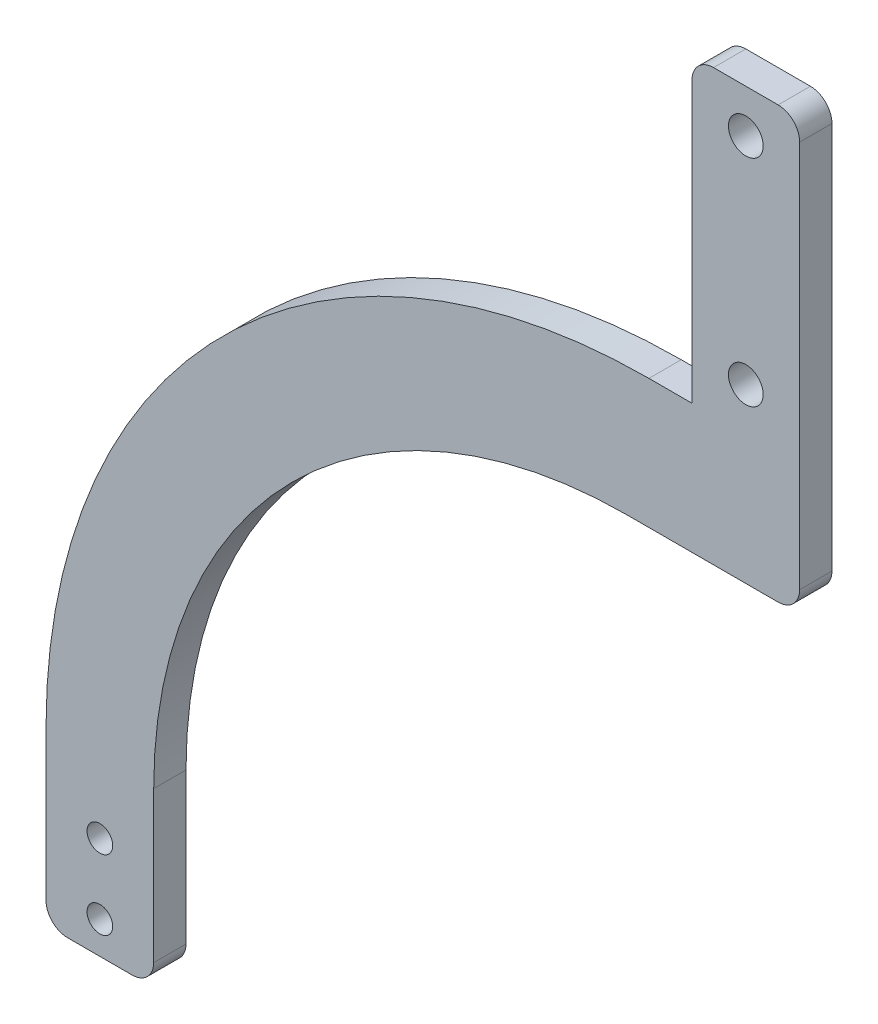
from build123d import *

# Parameters (mm, degrees)
SKETCH1_R           = 0.59563
SKETCH1_R_2         = 0.80645
BOSS_EXTRUDE1_DEPTH = 1.5
FILLET2_R           = 22
FILLET3_R           = 28
FILLET1_R           = 1


with BuildPart() as part:
    # Sketch1 → Boss-Extrude1 (new body)
    with BuildSketch(Plane.XY):
        Polygon((-2.5, -3.125), (-2.5, 3.875), (-2.5, 32.875), (27.5, 32.875), (27.5, 46.875), (32.5, 46.875), (32.5, 32.875), (32.5, 26.875), (2.5, 26.875), (2.5, 3.875), (2.5, -3.125), align=None)
        with Locations((0, 1.625)):
            Circle(SKETCH1_R, mode=Mode.SUBTRACT)
        with Locations((0, -1.625)):
            Circle(SKETCH1_R, mode=Mode.SUBTRACT)
        with Locations((30, 44.875)):
            Circle(SKETCH1_R_2, mode=Mode.SUBTRACT)
        with Locations((30, 34.875)):
            Circle(SKETCH1_R_2, mode=Mode.SUBTRACT)
    extrude(amount=BOSS_EXTRUDE1_DEPTH)

    # Fillet2
    fillet2_edges = [part.edges().sort_by_distance(p)[0] for p in [
        (2.5, 26.875, 0.75),
    ]]
    fillet(fillet2_edges, radius=FILLET2_R)

    # Fillet3
    fillet3_edges = [part.edges().sort_by_distance(p)[0] for p in [
        (-2.5, 32.875, 0.75),
    ]]
    fillet(fillet3_edges, radius=FILLET3_R)

    # Fillet1
    fillet1_edges = [part.edges().sort_by_distance(p)[0] for p in [
        (2.5, -3.125, 0.75),
        (-2.5, -3.125, 0.75),
        (27.5, 46.875, 0.75),
        (32.5, 46.875, 0.75),
        (32.5, 26.875, 0.75),
    ]]
    fillet(fillet1_edges, radius=FILLET1_R)


solid = part.part
